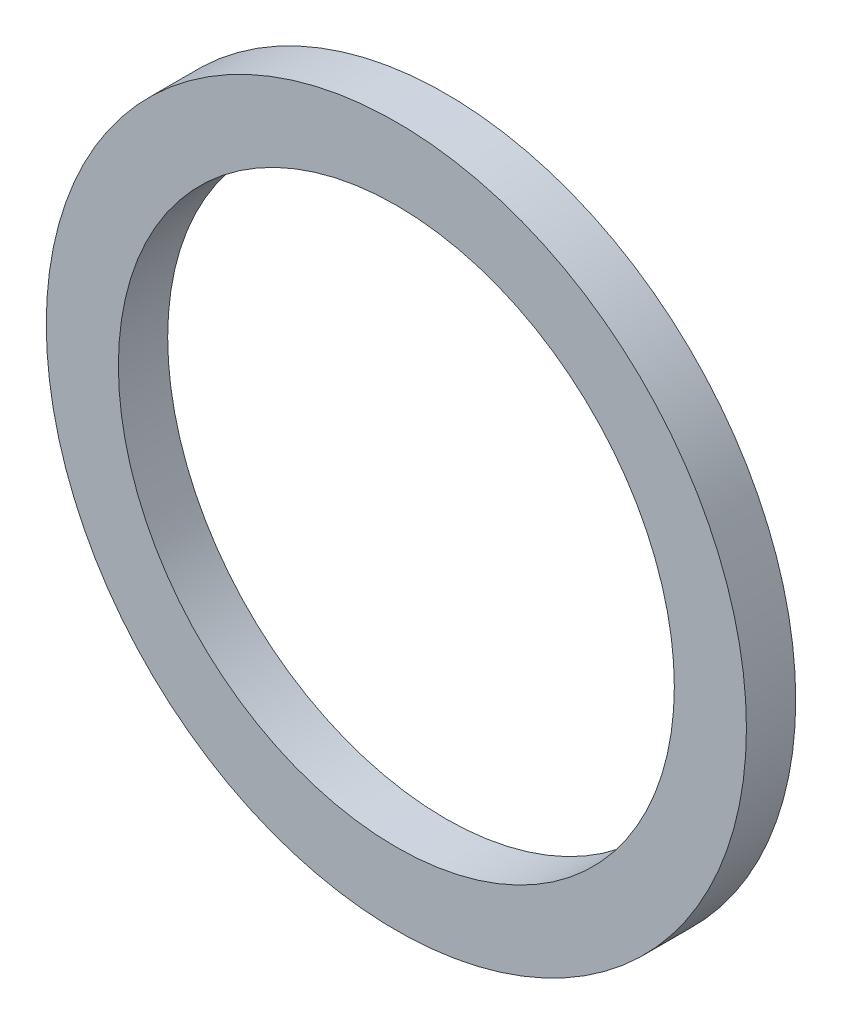
from build123d import *

# Parameters (mm, degrees)
SKETCH1_R           = 22.5425
SKETCH1_R_2         = 17.9
BOSS_EXTRUDE1_DEPTH = 3.175


with BuildPart() as part:
    # Sketch1 → Boss-Extrude1 (new body)
    with BuildSketch(Plane.XY):
        Circle(SKETCH1_R)
        Circle(SKETCH1_R_2, mode=Mode.SUBTRACT)
    extrude(amount=BOSS_EXTRUDE1_DEPTH)


solid = part.part
